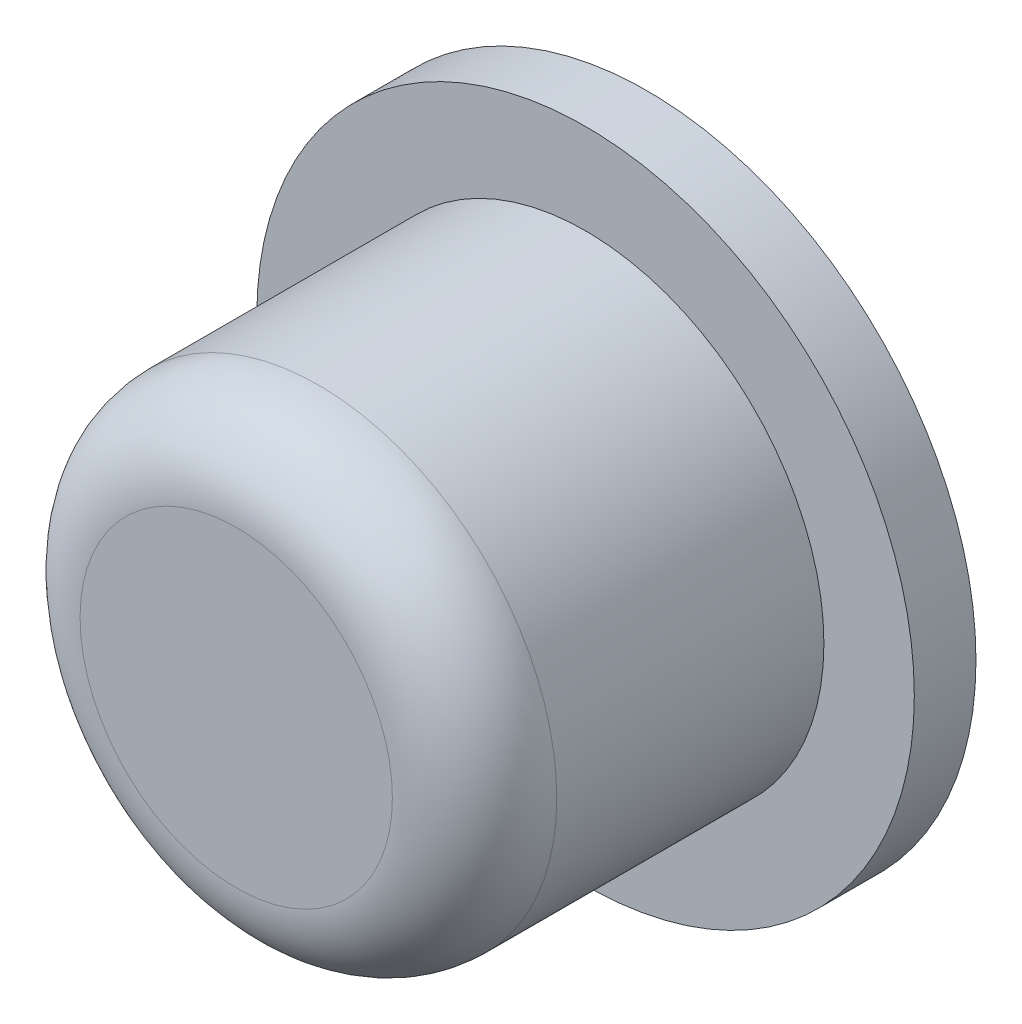
from build123d import *

# Parameters (mm, degrees)
SZKIC1_R                    = 4
DODANIE_WYCI_GNI_CIE1_DEPTH = 0.75
SZKIC2_R                    = 2.9
DODANIE_WYCI_GNI_CIE2_DEPTH = 4.25
SZKIC3_W                    = 2.5
SZKIC3_H                    = 2.5
WYTNIJ_WYCI_GNI_CIE1_DEPTH  = 1
ZAOKR_GLENIE2_R             = 1
SZKIC4_W                    = 2.9
SZKIC4_H                    = 2.9
WYTNIJ_WYCI_GNI_CIE2_DEPTH  = 1


with BuildPart() as part:
    # Szkic1 → Dodanie-wyciągnięcie1 (new body)
    with BuildSketch(Plane.XY):
        Circle(SZKIC1_R)
    extrude(amount=DODANIE_WYCI_GNI_CIE1_DEPTH)

    # Szkic2 → Dodanie-wyciągnięcie2 (add)
    with BuildSketch(Plane.XY.offset(0.75)):
        Circle(SZKIC2_R)
    extrude(amount=DODANIE_WYCI_GNI_CIE2_DEPTH)

    # Szkic3 → Wytnij-wyciągnięcie1 (cut)
    with BuildSketch(Plane(origin=(0, 0, 0), x_dir=(-1, 0, 0), z_dir=(0, 0, -1))):
        Rectangle(SZKIC3_W, SZKIC3_H)
    extrude(amount=-WYTNIJ_WYCI_GNI_CIE1_DEPTH, mode=Mode.SUBTRACT)

    # Zaokrąglenie2
    zaokr_glenie2_edges = [part.edges().sort_by_distance(p)[0] for p in [
        (-2.9, 0, 5),
    ]]
    fillet(zaokr_glenie2_edges, radius=ZAOKR_GLENIE2_R)

    # Szkic4 → Wytnij-wyciągnięcie2 (cut)
    with BuildSketch(Plane(origin=(0, 0, 0), x_dir=(-1, 0, 0), z_dir=(0, 0, -1))):
        Rectangle(SZKIC4_W, SZKIC4_H)
    extrude(amount=-WYTNIJ_WYCI_GNI_CIE2_DEPTH, mode=Mode.SUBTRACT)


solid = part.part
